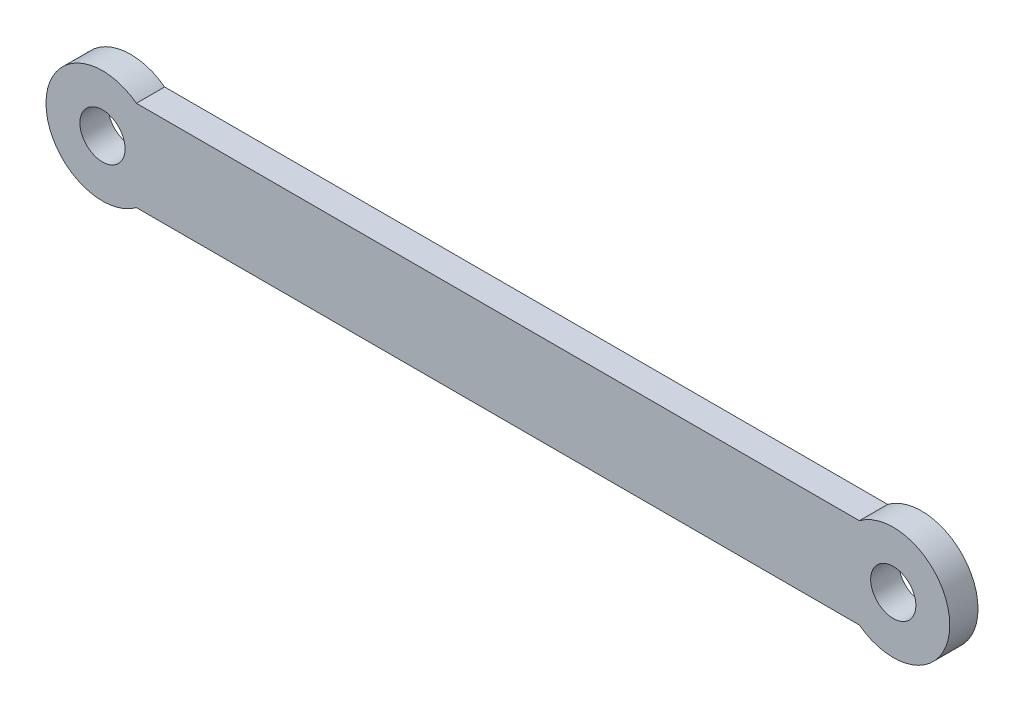
from build123d import *

# Parameters (mm, degrees)
SCHIZZO1_R                   = 4
ESTRUSIONE_ESTRUSIONE1_DEPTH = 5


with BuildPart() as part:
    # Schizzo1 → Estrusione-Estrusione1 (new body)
    with BuildSketch(Plane.XY):
        with BuildLine():
            Line((6, -8), (134, -8))
            ThreePointArc((134, -8), (150, 0), (134, 8))
            Line((134, 8), (6, 8))
            ThreePointArc((6, 8), (-10, 0), (6, -8))
        make_face()
        Circle(SCHIZZO1_R, mode=Mode.SUBTRACT)
        with Locations((140, 0)):
            Circle(SCHIZZO1_R, mode=Mode.SUBTRACT)
    extrude(amount=ESTRUSIONE_ESTRUSIONE1_DEPTH)


solid = part.part
